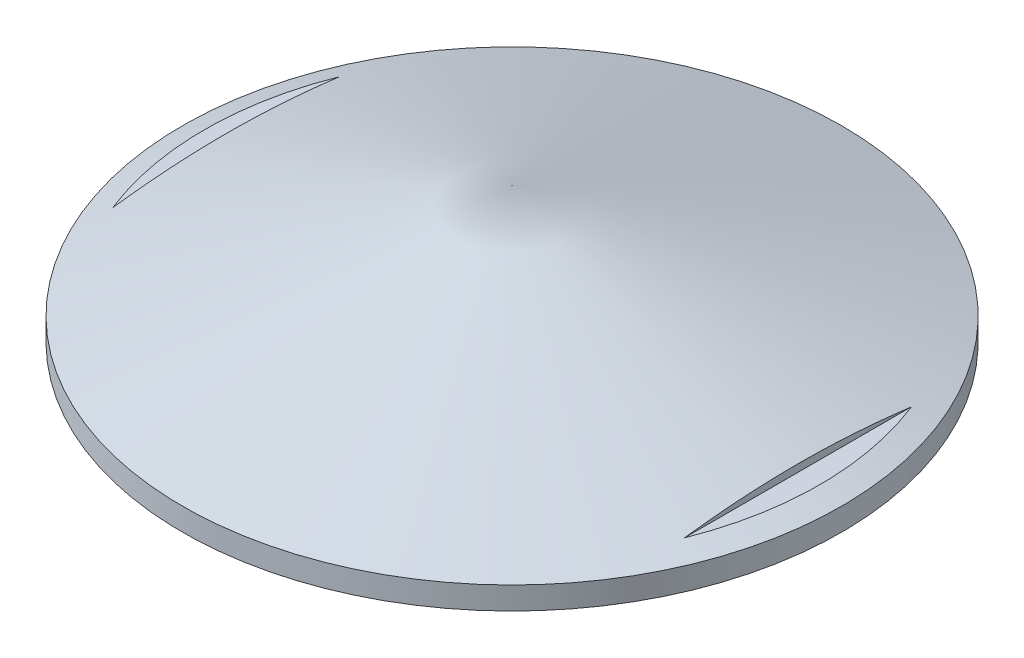
from build123d import *

# Parameters (mm, degrees)
SKETCH3_W          = 700
SKETCH3_H          = 2300
SKETCH3_W_2        = 800
CUT_EXTRUDE1_DEPTH = 2000


with BuildPart() as part:
    # Sketch2 → Revolve2 (revolve)
    with BuildSketch(Plane.XY, mode=Mode.PRIVATE) as revolve2_sk:
        Polygon((0, 78500), (4380, 77000), (4380, 76700), (0, 78200), align=None)
    revolve(revolve2_sk.sketch.rotate(Axis((0, 76500, 0), (0, 1, 0)), 90), axis=Axis((0, 76500, 0), (0, 1, 0)))

    # Sketch3 → Cut-Extrude1 (cut, symmetric)
    with BuildSketch(Plane.XY):
        with Locations((4150, 78250)):
            Rectangle(SKETCH3_W, SKETCH3_H)
        with Locations((-4200, 78250)):
            Rectangle(SKETCH3_W_2, SKETCH3_H)
    extrude(amount=CUT_EXTRUDE1_DEPTH, both=True, mode=Mode.SUBTRACT)


solid = part.part
